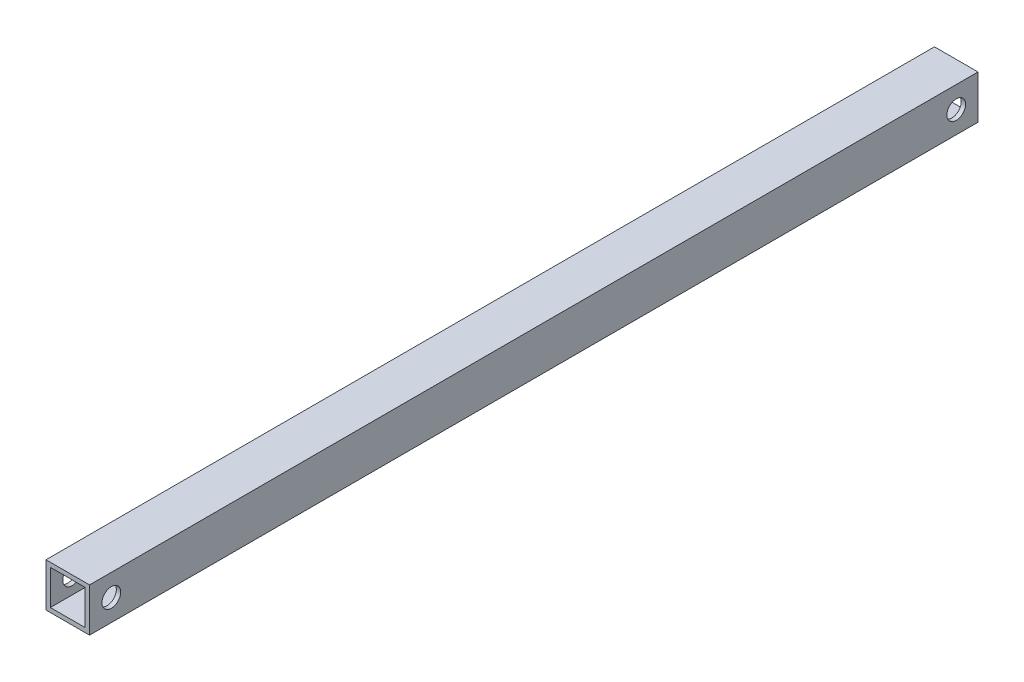
from build123d import *

# Parameters (mm, degrees)
SKETCH_1_W          = 10
SKETCH_1_H          = 10
SKETCH_1_W_2        = 8
SKETCH_1_H_2        = 8
EXTRUDE_1_DEPTH     = 204
SKETCH_2_R          = 2.15
CUT_EXTRUDE_1_DEPTH = 205.306142835


with BuildPart() as part:
    # ｽｹｯﾁ1 → 押し出し-薄板1 (new body)
    with BuildSketch(Plane.XY):
        Rectangle(SKETCH_1_W, SKETCH_1_H)
        Rectangle(SKETCH_1_W_2, SKETCH_1_H_2, mode=Mode.SUBTRACT)
    extrude(amount=EXTRUDE_1_DEPTH)

    # ｽｹｯﾁ2 → ｶｯﾄ - 押し出し1 (cut, through all)
    with BuildSketch(Plane(origin=(5, 0, 0), x_dir=(0, 0, -1), z_dir=(1, 0, 0))):
        with Locations(Location((-5, 0, 0), (0, 0, 90))):
            Circle(SKETCH_2_R)
        with Locations(Location((-199, 0, 0), (0, 0, 90))):
            Circle(SKETCH_2_R)
    extrude(amount=-CUT_EXTRUDE_1_DEPTH, mode=Mode.SUBTRACT)


solid = part.part
